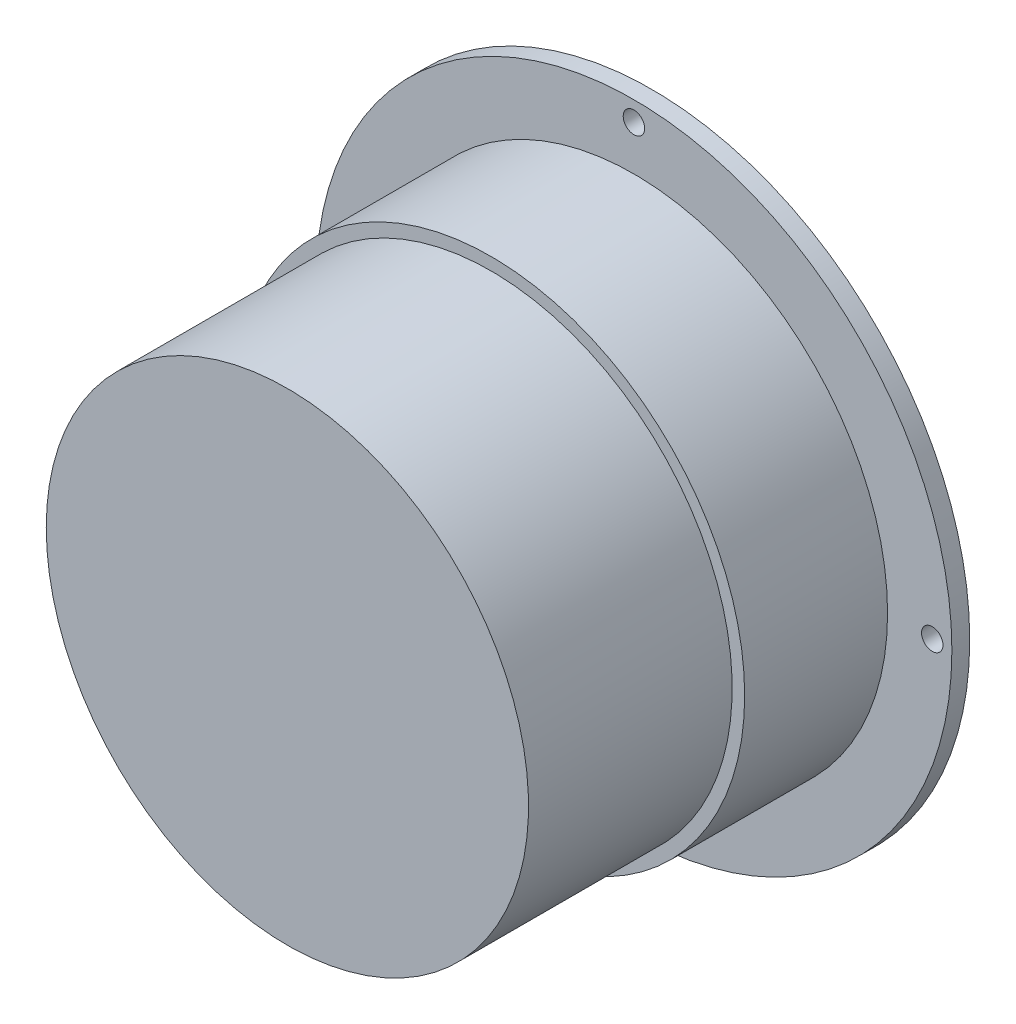
from build123d import *

# Parameters (mm, degrees)
SKETCH1_R           = 44.5
BOSS_EXTRUDE1_DEPTH = 2.5
SKETCH2_R           = 1.5
CUT_EXTRUDE1_DEPTH  = 63.982140326
SKETCH3_R           = 35.5
BOSS_EXTRUDE2_DEPTH = 20
SKETCH4_R           = 33.75
BOSS_EXTRUDE3_DEPTH = 28.5


with BuildPart() as part:
    # Sketch1 → Boss-Extrude1 (new body)
    with BuildSketch(Plane.XY):
        Circle(SKETCH1_R)
    extrude(amount=BOSS_EXTRUDE1_DEPTH)

    # Sketch2 → Cut-Extrude1 (cut, through all)
    with BuildSketch(Plane.XY.offset(2.5)):
        with Locations((0, 41.75)):
            Circle(SKETCH2_R)
        with Locations((41.75, 0)):
            Circle(SKETCH2_R)
        with Locations((0, -41.75)):
            Circle(SKETCH2_R)
        with Locations((-41.75, 0)):
            Circle(SKETCH2_R)
    extrude(amount=-CUT_EXTRUDE1_DEPTH, mode=Mode.SUBTRACT)

    # Sketch3 → Boss-Extrude2 (add)
    with BuildSketch(Plane.XY.offset(2.5)):
        Circle(SKETCH3_R)
    extrude(amount=BOSS_EXTRUDE2_DEPTH)

    # Sketch4 → Boss-Extrude3 (add)
    with BuildSketch(Plane.XY.offset(22.5)):
        with Locations(Location((0, 0, 0), (0, 0, 180))):
            Circle(SKETCH4_R)
    extrude(amount=BOSS_EXTRUDE3_DEPTH)


solid = part.part
